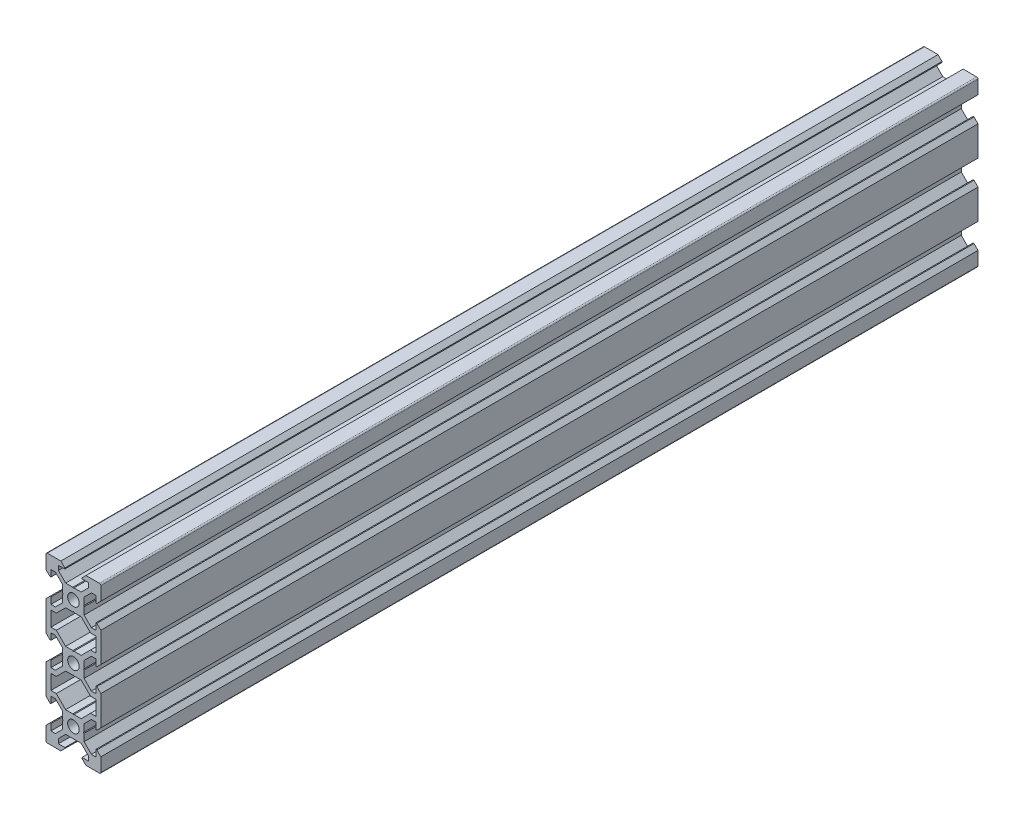
from build123d import *

# Parameters (mm, degrees)
BOSS_EXTRU_1_DEPTH = 320


with BuildPart() as part:
    # Esquisse1 → Boss.-Extru.1 (new body)
    with BuildSketch(Plane.XY):
        with BuildLine():
            Line((-9.5, 10), (-4.58, 10))
            Line((-4.58, 10), (-3.125, 8.545))
            Line((-3.125, 8.545), (-3.125, 8.2))
            Line((-3.125, 8.2), (-5.5, 8.2))
            Line((-5.5, 8.2), (-5.5, 6.560660172))
            Line((-5.5, 6.560660172), (-2.839339828, 3.9))
            Line((-2.839339828, 3.9), (-0.21, 3.9))
            Line((-0.21, 3.9), (0, 3.69))
            Line((0, 3.69), (0, 2.1))
            ThreePointArc((0, 2.1), (-2.1, 0), (0, -2.1))
            Line((0, -2.1), (0, -3.69))
            Line((0, -3.69), (-0.21, -3.9))
            Line((-0.21, -3.9), (-2.839339828, -3.9))
            Line((-2.839339828, -3.9), (-6.239339828, -7.3))
            Line((-6.239339828, -7.3), (-8.2, -7.3))
            Line((-8.2, -7.3), (-8.2, -12.7))
            Line((-8.2, -12.7), (-6.239339828, -12.7))
            Line((-6.239339828, -12.7), (-2.839339828, -16.1))
            Line((-2.839339828, -16.1), (-0.21, -16.1))
            Line((-0.21, -16.1), (0, -16.31))
            Line((0, -16.31), (0, -17.9))
            ThreePointArc((0, -17.9), (-2.1, -20), (0, -22.1))
            Line((0, -22.1), (0, -23.69))
            Line((0, -23.69), (-0.21, -23.9))
            Line((-0.21, -23.9), (-2.839339828, -23.9))
            Line((-2.839339828, -23.9), (-6.239339828, -27.3))
            Line((-6.239339828, -27.3), (-8.2, -27.3))
            Line((-8.2, -27.3), (-8.2, -32.7))
            Line((-8.2, -32.7), (-6.239339828, -32.7))
            Line((-6.239339828, -32.7), (-2.839339828, -36.1))
            Line((-2.839339828, -36.1), (-0.21, -36.1))
            Line((-0.21, -36.1), (0, -36.31))
            Line((0, -36.31), (0, -37.9))
            ThreePointArc((0, -37.9), (-2.1, -40), (0, -42.1))
            Line((0, -42.1), (0, -43.69))
            Line((0, -43.69), (-0.21, -43.9))
            Line((-0.21, -43.9), (-2.839339828, -43.9))
            Line((-2.839339828, -43.9), (-5.5, -46.560660172))
            Line((-5.5, -46.560660172), (-5.5, -48.2))
            Line((-5.5, -48.2), (-3.125, -48.2))
            Line((-3.125, -48.2), (-3.125, -48.545))
            Line((-3.125, -48.545), (-4.58, -50))
            Line((-4.58, -50), (-9.5, -50))
            ThreePointArc((-9.5, -50), (-9.853553391, -49.853553391), (-10, -49.5))
            Line((-10, -49.5), (-10, -44.58))
            Line((-10, -44.58), (-8.545, -43.125))
            Line((-8.545, -43.125), (-8.2, -43.125))
            Line((-8.2, -43.125), (-8.2, -45.5))
            Line((-8.2, -45.5), (-6.560660172, -45.5))
            Line((-6.560660172, -45.5), (-3.9, -42.839339828))
            Line((-3.9, -42.839339828), (-3.9, -40.21))
            Line((-3.9, -40.21), (-3.69, -40))
            Line((-3.69, -40), (-3.9, -39.79))
            Line((-3.9, -39.79), (-3.9, -37.160660172))
            Line((-3.9, -37.160660172), (-6.560660172, -34.5))
            Line((-6.560660172, -34.5), (-8.2, -34.5))
            Line((-8.2, -34.5), (-8.2, -36.875))
            Line((-8.2, -36.875), (-8.545, -36.875))
            Line((-8.545, -36.875), (-10, -35.42))
            Line((-10, -35.42), (-10, -24.58))
            Line((-10, -24.58), (-8.545, -23.125))
            Line((-8.545, -23.125), (-8.2, -23.125))
            Line((-8.2, -23.125), (-8.2, -25.5))
            Line((-8.2, -25.5), (-6.560660172, -25.5))
            Line((-6.560660172, -25.5), (-3.9, -22.839339828))
            Line((-3.9, -22.839339828), (-3.9, -20.21))
            Line((-3.9, -20.21), (-3.69, -20))
            Line((-3.69, -20), (-3.9, -19.79))
            Line((-3.9, -19.79), (-3.9, -17.160660172))
            Line((-3.9, -17.160660172), (-6.560660172, -14.5))
            Line((-6.560660172, -14.5), (-8.2, -14.5))
            Line((-8.2, -14.5), (-8.2, -16.875))
            Line((-8.2, -16.875), (-8.545, -16.875))
            Line((-8.545, -16.875), (-10, -15.42))
            Line((-10, -15.42), (-10, -4.58))
            Line((-10, -4.58), (-8.545, -3.125))
            Line((-8.545, -3.125), (-8.2, -3.125))
            Line((-8.2, -3.125), (-8.2, -5.5))
            Line((-8.2, -5.5), (-6.560660172, -5.5))
            Line((-6.560660172, -5.5), (-3.9, -2.839339828))
            Line((-3.9, -2.839339828), (-3.9, -0.21))
            Line((-3.9, -0.21), (-3.69, 0))
            Line((-3.69, 0), (-3.9, 0.21))
            Line((-3.9, 0.21), (-3.9, 2.839339828))
            Line((-3.9, 2.839339828), (-6.560660172, 5.5))
            Line((-6.560660172, 5.5), (-8.2, 5.5))
            Line((-8.2, 5.5), (-8.2, 3.125))
            Line((-8.2, 3.125), (-8.545, 3.125))
            Line((-8.545, 3.125), (-10, 4.58))
            Line((-10, 4.58), (-10, 9.5))
            ThreePointArc((-10, 9.5), (-9.853553391, 9.853553391), (-9.5, 10))
        make_face()
    boss_extru_1 = extrude(amount=BOSS_EXTRU_1_DEPTH)

    # Symétrie1: Boss.-Extru.1 across plane
    add(boss_extru_1.mirror(Plane(origin=(0, 3.69, 320), x_dir=(0, 0, 1), z_dir=(-1, 0, 0))))


solid = part.part
